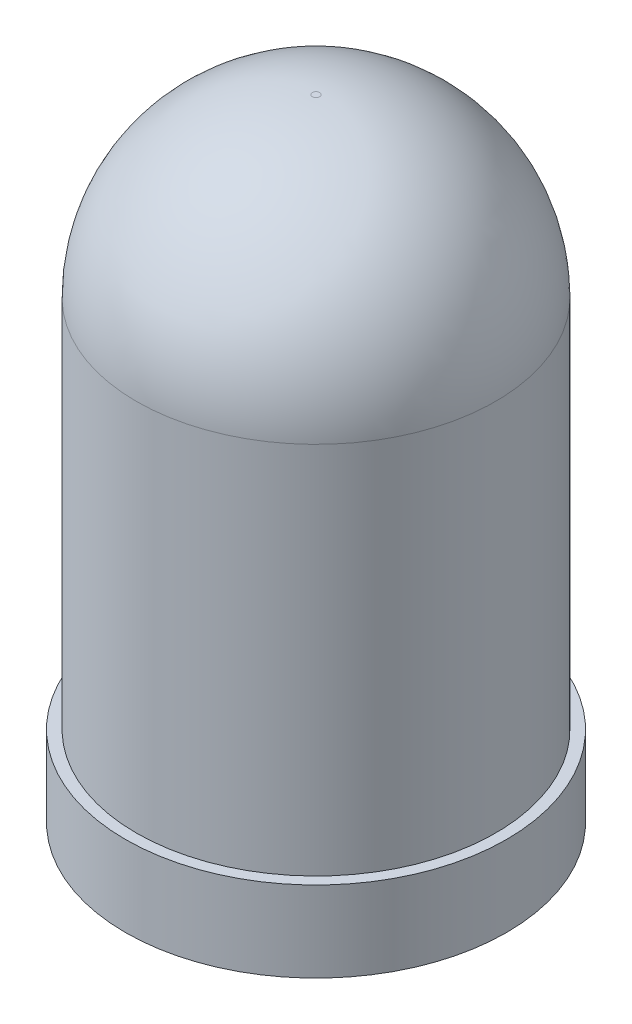
from build123d import *


with BuildPart() as part:
    # Croquis1 → Revolución1 (revolve)
    with BuildSketch(Plane.XY, mode=Mode.PRIVATE) as revoluci_n1_sk:
        with BuildLine():
            Line((0, 0), (2.6, 0))
            Line((2.6, 0), (2.6, 1.1))
            Line((2.6, 1.1), (2.45, 1.1))
            Line((2.45, 1.1), (2.45, 6.2))
            ThreePointArc((2.45, 6.2), (1.747056275, 7.897056275), (0.05, 8.6))
            Line((0.05, 8.6), (0, 8.6))
            Line((0, 8.6), (0, 0))
        make_face()
    revolve(revoluci_n1_sk.sketch.rotate(Axis((0, 0, 0), (0, 1, 0)), 90), axis=Axis((0, 0, 0), (0, 1, 0)))


solid = part.part
